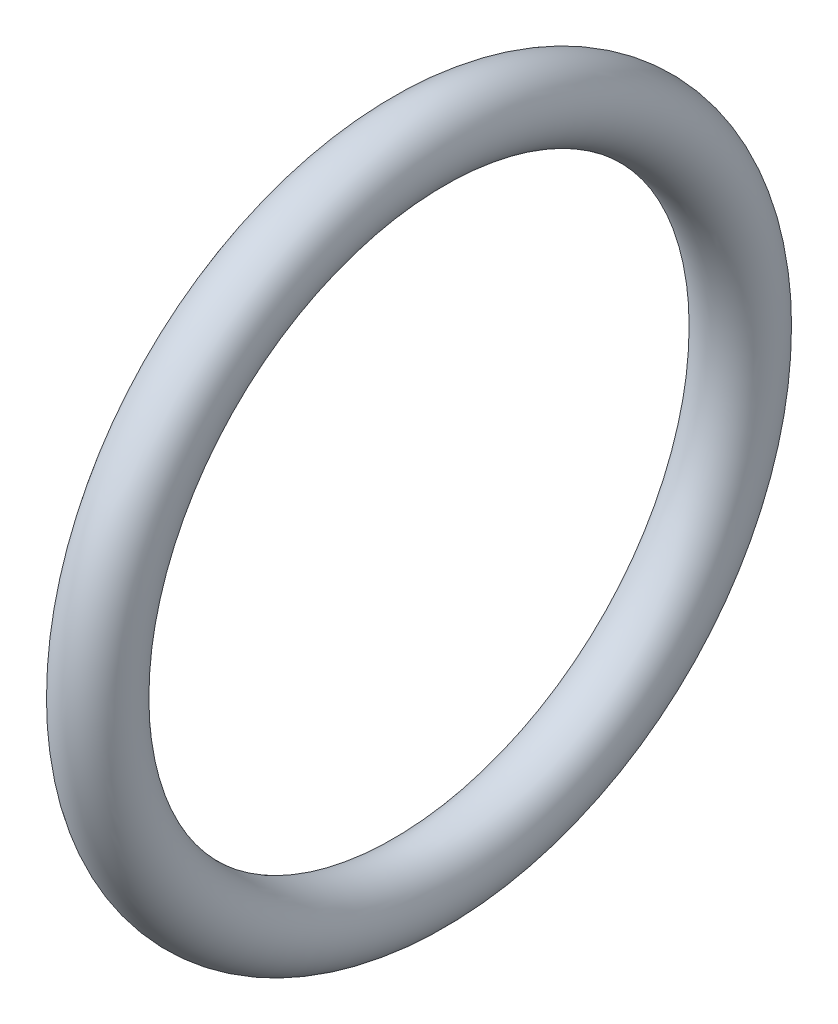
from build123d import *

# Parameters (mm, degrees)
SKETCH_1_R = 1.55


with BuildPart() as part:
    # ｽｹｯﾁ1 → 回転1 (revolve)
    with BuildSketch(Plane.XY):
        with Locations((0, 13.75)):
            Circle(SKETCH_1_R)
    revolve(axis=Axis((0, 0, 0), (1, 0, 0)))


solid = part.part
